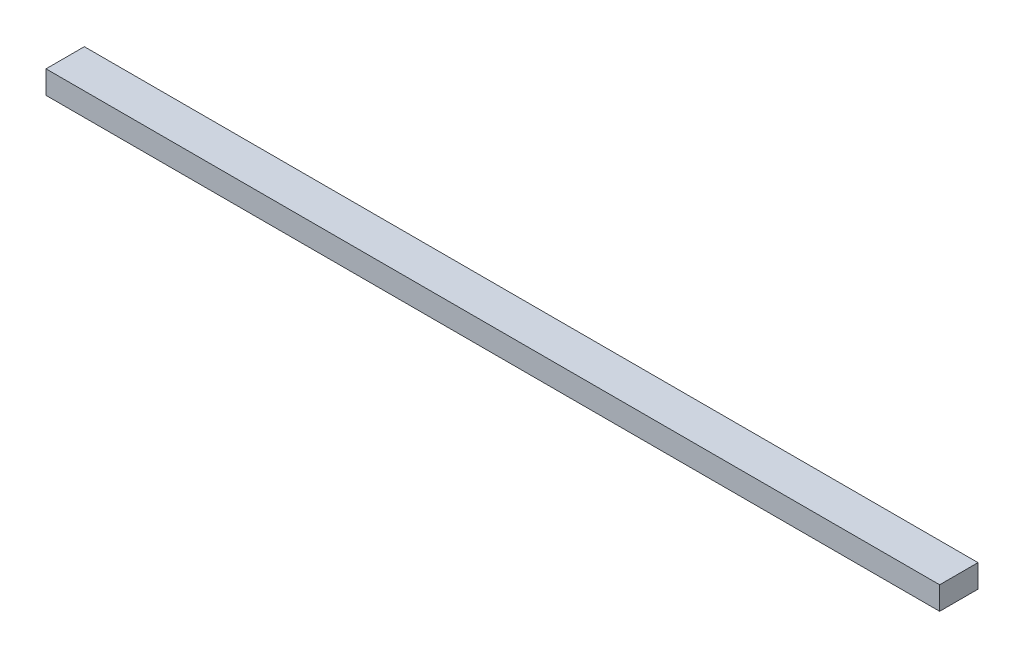
from build123d import *

# Parameters (mm, degrees)
SKETCH1_W           = 2330
SKETCH1_H           = 100
BOSS_EXTRUDE1_DEPTH = 60


with BuildPart() as part:
    # Sketch1 → Boss-Extrude1 (new body)
    with BuildSketch(Plane(origin=(0, 0, 0), x_dir=(1, 0, 0), z_dir=(0, 1, 0))):
        with Locations((1165, 50)):
            Rectangle(SKETCH1_W, SKETCH1_H)
    extrude(amount=BOSS_EXTRUDE1_DEPTH)


solid = part.part
